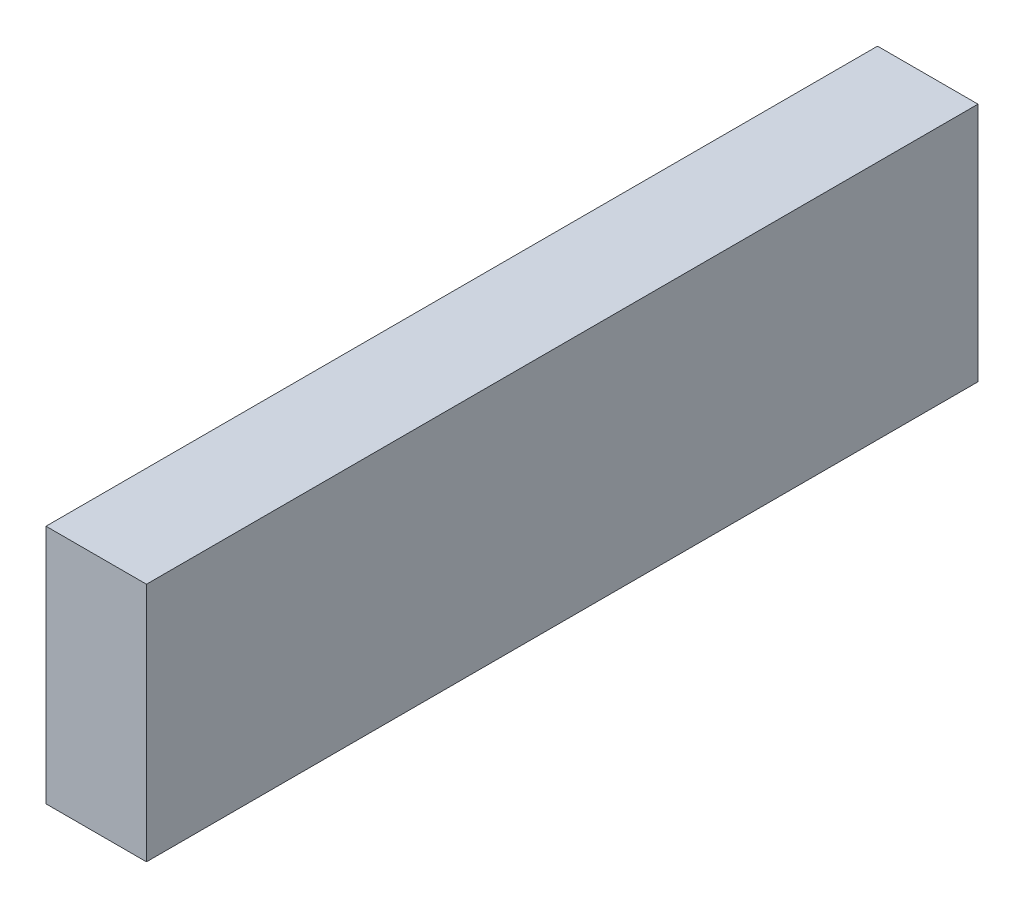
from build123d import *

# Parameters (mm, degrees)
SKETCH1_W           = 18.415
SKETCH1_H           = 44.069
BOSS_EXTRUDE1_DEPTH = 76.2
SKETCH2_R           = 9.9187
CUT_EXTRUDE1_DEPTH  = 12.7
SKETCH3_R           = 9.525
BOSS_EXTRUDE2_DEPTH = 12.7
CUT_EXTRUDE2_DEPTH  = 6.35
CHAMFER1_SIZE       = 0.635


with BuildPart() as part:
    # Sketch1 → Boss-Extrude1 (new, symmetric)
    with BuildSketch(Plane.XY):
        with Locations((9.2075, 22.0345)):
            Rectangle(SKETCH1_W, SKETCH1_H)
    extrude(amount=BOSS_EXTRUDE1_DEPTH, both=True)

    # Sketch2 → Cut-Extrude1 (cut)
    with BuildSketch(Plane(origin=(0, 0, 0), x_dir=(0, 0, -1), z_dir=(1, 0, 0))):
        with Locations((-49.6062, 23.876)):
            Circle(SKETCH2_R)
        with Locations((49.6062, 23.876)):
            Circle(SKETCH2_R)
    extrude(amount=CUT_EXTRUDE1_DEPTH, mode=Mode.SUBTRACT)

    # Sketch3 → Boss-Extrude2 (add)
    with BuildSketch(Plane.ZY.offset(-12.7)):
        with Locations(Location((49.6062, 23.876, 0), (0, 0, 180))):
            Circle(SKETCH3_R)
        with Locations(Location((-49.6062, 23.876, 0), (0, 0, 180))):
            Circle(SKETCH3_R)
    extrude(amount=BOSS_EXTRUDE2_DEPTH)

    # Sketch4 → Cut-Extrude2 (cut)
    with BuildSketch(Plane.ZY):
        Polygon((42.293794683, 24.416427442), (45.481973448, 17.813484954), (52.794378764, 17.273057512), (56.918605317, 23.335572558), (53.730426552, 29.938515046), (46.418021236, 30.478942488), align=None)
        Polygon((-42.293794683, 24.416427442), (-46.418021236, 30.478942488), (-53.730426552, 29.938515046), (-56.918605317, 23.335572558), (-52.794378764, 17.273057512), (-45.481973448, 17.813484954), align=None)
    extrude(amount=-CUT_EXTRUDE2_DEPTH, mode=Mode.SUBTRACT)

    # Chamfer1
    chamfer1_edges = [part.edges().sort_by_distance(p)[0] for p in [
        (0, 23.876, 59.1312),
        (0, 23.876, -40.0812),
    ]]
    chamfer(chamfer1_edges, length=CHAMFER1_SIZE)


solid = part.part
